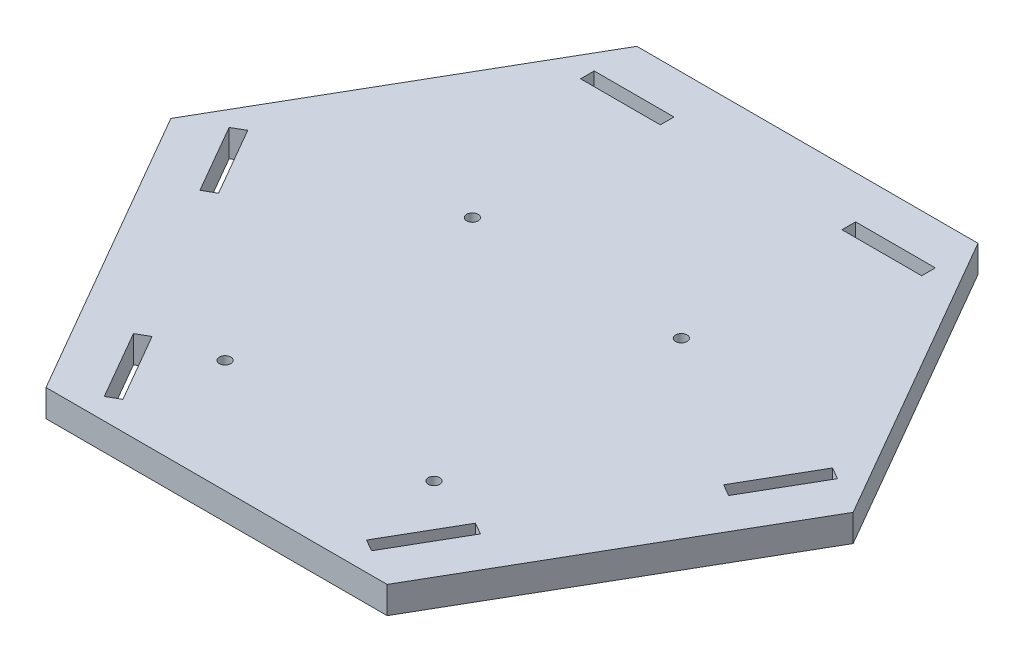
from build123d import *

# Parameters (mm, degrees)
SKETCH1_W           = 18.7
SKETCH1_H           = 3.2
BOSS_EXTRUDE1_DEPTH = 6.35
SKETCH2_R           = 1.35
CUT_EXTRUDE1_DEPTH  = 6.35


with BuildPart() as part:
    # Sketch1 → Boss-Extrude1 (new body)
    with BuildSketch(Plane(origin=(0, 0, 0), x_dir=(1, 0, 0), z_dir=(0, 1, 0))):
        Polygon((40, -69.282032303), (80, 0), (40, 69.282032303), (-40, 69.282032303), (-80, 0), (-40, -69.282032303), align=None)
        Polygon((-68.56846467, 6.6), (-59.21846467, -9.594675051), (-61.989745962, -11.194675051), (-71.339745962, 5), align=None, mode=Mode.SUBTRACT)
        Polygon((-31.339745962, -64.282032303), (-28.56846467, -62.682032303), (-37.91846467, -46.487357252), (-40.689745962, -48.087357252), align=None, mode=Mode.SUBTRACT)
        Polygon((28.56846467, -62.682032303), (37.91846467, -46.487357252), (40.689745962, -48.087357252), (31.339745962, -64.282032303), align=None, mode=Mode.SUBTRACT)
        Polygon((71.339745962, 5), (68.56846467, 6.6), (59.21846467, -9.594675051), (61.989745962, -11.194675051), align=None, mode=Mode.SUBTRACT)
        with Locations((30.65, 57.682032303)):
            Rectangle(SKETCH1_W, SKETCH1_H, mode=Mode.SUBTRACT)
        with Locations((-30.65, 57.682032303)):
            Rectangle(SKETCH1_W, SKETCH1_H, mode=Mode.SUBTRACT)
    extrude(amount=BOSS_EXTRUDE1_DEPTH)

    # Sketch2 → Cut-Extrude1 (cut)
    with BuildSketch(Plane(origin=(0, 6.35, 0), x_dir=(1, 0, 0), z_dir=(0, 1, 0))):
        with Locations(Location((-24.5, -42.782032303, 0), (0, 0, 270))):
            Circle(SKETCH2_R)
        with Locations(Location((24.5, -42.782032303, 0), (0, 0, 270))):
            Circle(SKETCH2_R)
        with Locations(Location((24.5, 15.217967697, 0), (0, 0, 270))):
            Circle(SKETCH2_R)
        with Locations(Location((-24.5, 15.217967697, 0), (0, 0, 270))):
            Circle(SKETCH2_R)
    extrude(amount=-CUT_EXTRUDE1_DEPTH, mode=Mode.SUBTRACT)


solid = part.part
